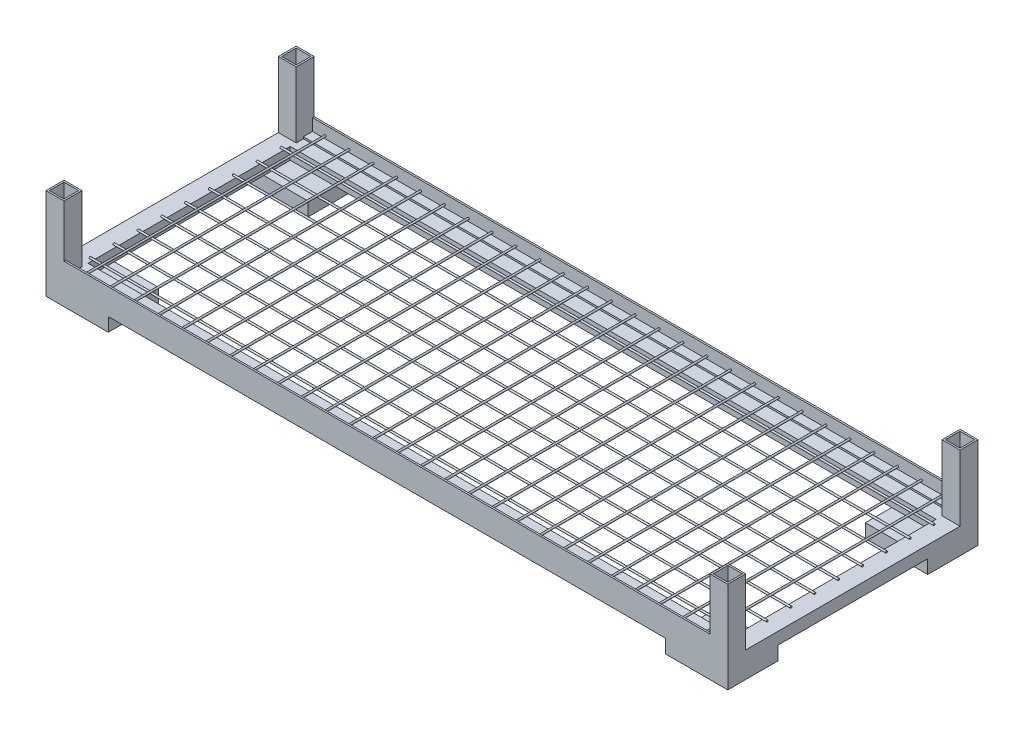
from build123d import *

# Parameters (mm, degrees)
SKETCH1_W             = 1444.625
SKETCH1_H             = 530.225
SKETCH1_W_2           = 1368.425
SKETCH1_H_2           = 428.625
BOSS_EXTRUDE1_DEPTH   = 25.4
SKETCH2_W             = 38.1
SKETCH2_H             = 38.1
SKETCH2_W_2           = 30.988
SKETCH2_H_2           = 30.988
BOSS_EXTRUDE2_DEPTH   = 139.7
SKETCH3_W             = 1368.425
SKETCH3_H             = 22.86
BOSS_EXTRUDE3_DEPTH   = 3.81
SKETCH4_R             = 1.905
BOSS_EXTRUDE4_DEPTH   = 1384.3
BOSS_EXTRUDE4_2_DEPTH = 1384.3
BOSS_EXTRUDE4_3_DEPTH = 1384.3
BOSS_EXTRUDE4_4_DEPTH = 1384.3
BOSS_EXTRUDE4_5_DEPTH = 1384.3
BOSS_EXTRUDE4_6_DEPTH = 1384.3
BOSS_EXTRUDE4_7_DEPTH = 1384.3
BOSS_EXTRUDE4_8_DEPTH = 1384.3
BOSS_EXTRUDE4_9_DEPTH = 1384.3
SKETCH5_W             = 1368.425
SKETCH5_H             = 3.556
BOSS_EXTRUDE5_DEPTH   = 25.4
SKETCH6_R             = 1.905
BOSS_EXTRUDE6_DEPTH   = 523.113
SKETCH7_W             = 132.08
SKETCH7_H             = 106.68
BOSS_EXTRUDE7_DEPTH   = 3.556
SKETCH8_W             = 132.08
SKETCH8_H             = 106.68
SKETCH8_W_2           = 124.968
SKETCH8_H_2           = 99.568
BOSS_EXTRUDE8_DEPTH   = 25.4


with BuildPart() as part:
    # Sketch1 → Boss-Extrude1 (new body)
    with BuildSketch(Plane(origin=(0, 0, 0), x_dir=(1, 0, 0), z_dir=(0, 1, 0))):
        Rectangle(SKETCH1_W, SKETCH1_H)
        Rectangle(SKETCH1_W_2, SKETCH1_H_2, mode=Mode.SUBTRACT)
    extrude(amount=BOSS_EXTRUDE1_DEPTH)

    # Sketch2 → Boss-Extrude2 (add)
    # profile 1 of 4: a face of its own
    with BuildSketch(Plane(origin=(0, 25.4, 0), x_dir=(1, 0, 0), z_dir=(0, 1, 0))):
        with Locations((-703.2625, 246.0625)):
            Rectangle(SKETCH2_W, SKETCH2_H)
        with Locations((-703.2625, 246.0625)):
            Rectangle(SKETCH2_W_2, SKETCH2_H_2, mode=Mode.SUBTRACT)
    # profile 2 of 4: a face of its own
    with BuildSketch(Plane(origin=(0, 25.4, 0), x_dir=(1, 0, 0), z_dir=(0, 1, 0))):
        with Locations((-703.2625, -246.0625)):
            Rectangle(SKETCH2_W, SKETCH2_H)
        with Locations((-703.2625, -246.0625)):
            Rectangle(SKETCH2_W_2, SKETCH2_H_2, mode=Mode.SUBTRACT)
    # profile 3 of 4: a face of its own
    with BuildSketch(Plane(origin=(0, 25.4, 0), x_dir=(1, 0, 0), z_dir=(0, 1, 0))):
        with Locations((703.2625, -246.0625)):
            Rectangle(SKETCH2_W, SKETCH2_H)
        with Locations((703.2625, -246.0625)):
            Rectangle(SKETCH2_W_2, SKETCH2_H_2, mode=Mode.SUBTRACT)
    # profile 4 of 4: a face of its own
    with BuildSketch(Plane(origin=(0, 25.4, 0), x_dir=(1, 0, 0), z_dir=(0, 1, 0))):
        with Locations((703.2625, 246.0625)):
            Rectangle(SKETCH2_W, SKETCH2_H)
        with Locations((703.2625, 246.0625)):
            Rectangle(SKETCH2_W_2, SKETCH2_H_2, mode=Mode.SUBTRACT)
    extrude(amount=BOSS_EXTRUDE2_DEPTH)

    # Sketch3 → Boss-Extrude3 (add)
    with BuildSketch(Plane(origin=(0, 25.4, 0), x_dir=(1, 0, 0), z_dir=(0, 1, 0))):
        with Locations((0, 253.6825)):
            Rectangle(SKETCH3_W, SKETCH3_H)
        with Locations((0, -253.6825)):
            Rectangle(SKETCH3_W, SKETCH3_H)
    extrude(amount=BOSS_EXTRUDE3_DEPTH)

    # Sketch5 → Boss-Extrude5 (add)
    with BuildSketch(Plane(origin=(0, 29.21, 0), x_dir=(1, 0, 0), z_dir=(0, 1, 0))):
        with Locations((0, -263.3345)):
            Rectangle(SKETCH5_W, SKETCH5_H)
        with Locations((0, 263.3345)):
            Rectangle(SKETCH5_W, SKETCH5_H)
    extrude(amount=BOSS_EXTRUDE5_DEPTH)

    # Sketch6 → Boss-Extrude6 (add)
    with BuildSketch(Plane(origin=(0, 0, 261.5565), x_dir=(-1, 0, 0), z_dir=(0, 0, -1))):
        with Locations(Location((0, 34.925, 0), (0, 0, 180))):
            Circle(SKETCH6_R)
        with Locations(Location((50.546, 34.925, 0), (0, 0, 180))):
            Circle(SKETCH6_R)
        with Locations(Location((101.092, 34.925, 0), (0, 0, 180))):
            Circle(SKETCH6_R)
        with Locations(Location((151.638, 34.925, 0), (0, 0, 180))):
            Circle(SKETCH6_R)
        with Locations(Location((202.184, 34.925, 0), (0, 0, 180))):
            Circle(SKETCH6_R)
        with Locations(Location((252.73, 34.925, 0), (0, 0, 180))):
            Circle(SKETCH6_R)
        with Locations(Location((303.276, 34.925, 0), (0, 0, 180))):
            Circle(SKETCH6_R)
        with Locations(Location((353.822, 34.925, 0), (0, 0, 180))):
            Circle(SKETCH6_R)
        with Locations(Location((404.368, 34.925, 0), (0, 0, 180))):
            Circle(SKETCH6_R)
        with Locations(Location((454.914, 34.925, 0), (0, 0, 180))):
            Circle(SKETCH6_R)
        with Locations(Location((505.46, 34.925, 0), (0, 0, 180))):
            Circle(SKETCH6_R)
        with Locations(Location((556.006, 34.925, 0), (0, 0, 180))):
            Circle(SKETCH6_R)
        with Locations(Location((606.552, 34.925, 0), (0, 0, 180))):
            Circle(SKETCH6_R)
        with Locations(Location((657.098, 34.925, 0), (0, 0, 180))):
            Circle(SKETCH6_R)
        with Locations(Location((-50.546, 34.925, 0), (0, 0, 180))):
            Circle(SKETCH6_R)
        with Locations(Location((-101.092, 34.925, 0), (0, 0, 180))):
            Circle(SKETCH6_R)
        with Locations(Location((-151.638, 34.925, 0), (0, 0, 180))):
            Circle(SKETCH6_R)
        with Locations(Location((-202.184, 34.925, 0), (0, 0, 180))):
            Circle(SKETCH6_R)
        with Locations(Location((-252.73, 34.925, 0), (0, 0, 180))):
            Circle(SKETCH6_R)
        with Locations(Location((-303.276, 34.925, 0), (0, 0, 180))):
            Circle(SKETCH6_R)
        with Locations(Location((-353.822, 34.925, 0), (0, 0, 180))):
            Circle(SKETCH6_R)
        with Locations(Location((-404.368, 34.925, 0), (0, 0, 180))):
            Circle(SKETCH6_R)
        with Locations(Location((-454.914, 34.925, 0), (0, 0, 180))):
            Circle(SKETCH6_R)
        with Locations(Location((-505.46, 34.925, 0), (0, 0, 180))):
            Circle(SKETCH6_R)
        with Locations(Location((-556.006, 34.925, 0), (0, 0, 180))):
            Circle(SKETCH6_R)
        with Locations(Location((-606.552, 34.925, 0), (0, 0, 180))):
            Circle(SKETCH6_R)
        with Locations(Location((-657.098, 34.925, 0), (0, 0, 180))):
            Circle(SKETCH6_R)
    extrude(amount=BOSS_EXTRUDE6_DEPTH)

    # Sketch7 → Boss-Extrude7 (add)
    with BuildSketch(Plane.XZ):
        with Locations((-656.2725, -211.7725)):
            Rectangle(SKETCH7_W, SKETCH7_H)
        with Locations((-656.2725, 211.7725)):
            Rectangle(SKETCH7_W, SKETCH7_H)
        with Locations((656.2725, -211.7725)):
            Rectangle(SKETCH7_W, SKETCH7_H)
        with Locations((656.2725, 211.7725)):
            Rectangle(SKETCH7_W, SKETCH7_H)
    extrude(amount=BOSS_EXTRUDE7_DEPTH)

    # Sketch8 → Boss-Extrude8 (add)
    # profile 1 of 4: a face of its own
    with BuildSketch(Plane.XZ.offset(3.556)):
        with Locations((-656.2725, -211.7725)):
            Rectangle(SKETCH8_W, SKETCH8_H)
        with Locations((-656.2725, -211.7725)):
            Rectangle(SKETCH8_W_2, SKETCH8_H_2, mode=Mode.SUBTRACT)
    # profile 2 of 4: a face of its own
    with BuildSketch(Plane.XZ.offset(3.556)):
        with Locations((-656.2725, 211.7725)):
            Rectangle(SKETCH8_W, SKETCH8_H)
        with Locations((-656.2725, 211.7725)):
            Rectangle(SKETCH8_W_2, SKETCH8_H_2, mode=Mode.SUBTRACT)
    # profile 3 of 4: a face of its own
    with BuildSketch(Plane.XZ.offset(3.556)):
        with Locations((656.2725, 211.7725)):
            Rectangle(SKETCH8_W, SKETCH8_H)
        with Locations((656.2725, 211.7725)):
            Rectangle(SKETCH8_W_2, SKETCH8_H_2, mode=Mode.SUBTRACT)
    # profile 4 of 4: a face of its own
    with BuildSketch(Plane.XZ.offset(3.556)):
        with Locations((656.2725, -211.7725)):
            Rectangle(SKETCH8_W, SKETCH8_H)
        with Locations((656.2725, -211.7725)):
            Rectangle(SKETCH8_W_2, SKETCH8_H_2, mode=Mode.SUBTRACT)
    extrude(amount=BOSS_EXTRUDE8_DEPTH)


with BuildPart() as body_2:
    # Sketch4 → Boss-Extrude4 (new body)
    with BuildSketch(Plane(origin=(-690.5625, 0, 0), x_dir=(0, 0, -1), z_dir=(1, 0, 0))):
        with Locations((-1.318131718, 27.305)):
            Circle(SKETCH4_R)
    extrude(amount=BOSS_EXTRUDE4_DEPTH)


with BuildPart() as body_3:
    # Sketch4 → Boss-Extrude4 2 (new body)
    with BuildSketch(Plane(origin=(-690.5625, 0, 0), x_dir=(0, 0, -1), z_dir=(1, 0, 0))):
        with Locations((49.227868282, 27.305)):
            Circle(SKETCH4_R)
    extrude(amount=BOSS_EXTRUDE4_2_DEPTH)


with BuildPart() as body_4:
    # Sketch4 → Boss-Extrude4 3 (new body)
    with BuildSketch(Plane(origin=(-690.5625, 0, 0), x_dir=(0, 0, -1), z_dir=(1, 0, 0))):
        with Locations((99.773868282, 27.305)):
            Circle(SKETCH4_R)
    extrude(amount=BOSS_EXTRUDE4_3_DEPTH)


with BuildPart() as body_5:
    # Sketch4 → Boss-Extrude4 4 (new body)
    with BuildSketch(Plane(origin=(-690.5625, 0, 0), x_dir=(0, 0, -1), z_dir=(1, 0, 0))):
        with Locations((150.319868282, 27.305)):
            Circle(SKETCH4_R)
    extrude(amount=BOSS_EXTRUDE4_4_DEPTH)


with BuildPart() as body_6:
    # Sketch4 → Boss-Extrude4 5 (new body)
    with BuildSketch(Plane(origin=(-690.5625, 0, 0), x_dir=(0, 0, -1), z_dir=(1, 0, 0))):
        with Locations((200.865868282, 27.305)):
            Circle(SKETCH4_R)
    extrude(amount=BOSS_EXTRUDE4_5_DEPTH)


with BuildPart() as body_7:
    # Sketch4 → Boss-Extrude4 6 (new body)
    with BuildSketch(Plane(origin=(-690.5625, 0, 0), x_dir=(0, 0, -1), z_dir=(1, 0, 0))):
        with Locations((-51.864131718, 27.305)):
            Circle(SKETCH4_R)
    extrude(amount=BOSS_EXTRUDE4_6_DEPTH)


with BuildPart() as body_8:
    # Sketch4 → Boss-Extrude4 7 (new body)
    with BuildSketch(Plane(origin=(-690.5625, 0, 0), x_dir=(0, 0, -1), z_dir=(1, 0, 0))):
        with Locations((-102.410131718, 27.305)):
            Circle(SKETCH4_R)
    extrude(amount=BOSS_EXTRUDE4_7_DEPTH)


with BuildPart() as body_9:
    # Sketch4 → Boss-Extrude4 8 (new body)
    with BuildSketch(Plane(origin=(-690.5625, 0, 0), x_dir=(0, 0, -1), z_dir=(1, 0, 0))):
        with Locations((-152.956131718, 27.305)):
            Circle(SKETCH4_R)
    extrude(amount=BOSS_EXTRUDE4_8_DEPTH)


with BuildPart() as body_10:
    # Sketch4 → Boss-Extrude4 9 (new body)
    with BuildSketch(Plane(origin=(-690.5625, 0, 0), x_dir=(0, 0, -1), z_dir=(1, 0, 0))):
        with Locations((-203.502131718, 27.305)):
            Circle(SKETCH4_R)
    extrude(amount=BOSS_EXTRUDE4_9_DEPTH)


solid = Compound([part.part, body_2.part, body_3.part, body_4.part, body_5.part, body_6.part, body_7.part, body_8.part, body_9.part, body_10.part])
